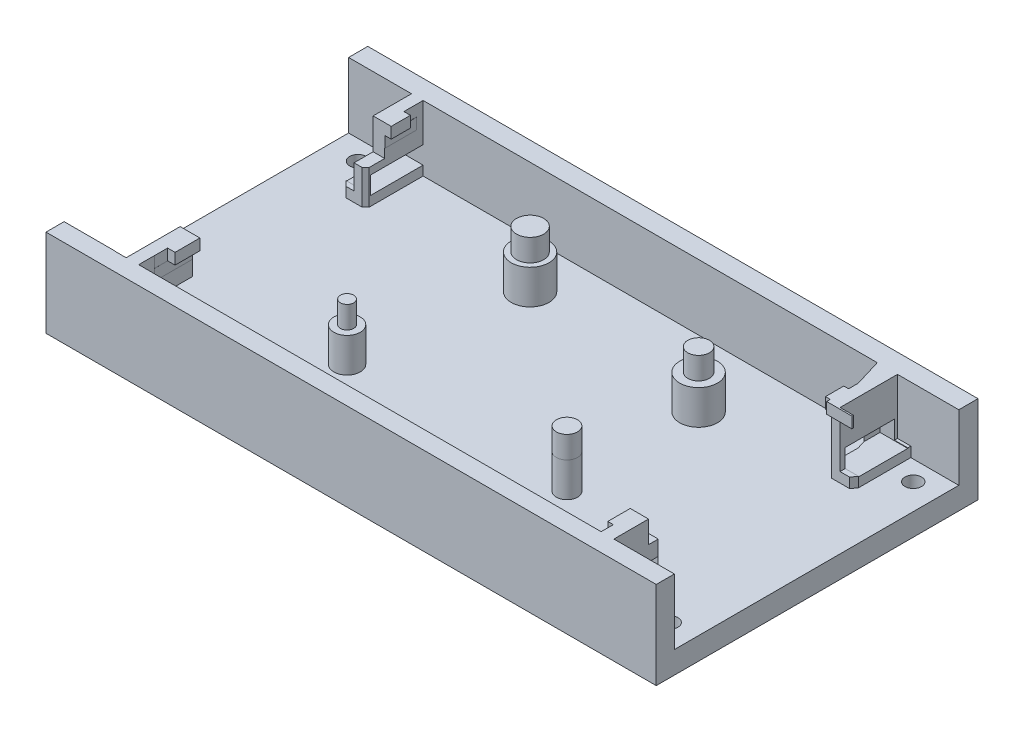
from build123d import *

# Parameters (mm, degrees)
SKETCH1_W            = 110
SKETCH1_H            = 58
BOSS_EXTRUDE1_DEPTH  = 4
SKETCH2_R            = 3.398974158
SKETCH2_R_2          = 3.407761536
SKETCH2_R_3          = 1.902710934
SKETCH2_R_4          = 2.384440654
BOSS_EXTRUDE2_DEPTH  = 1.6
BOSS_EXTRUDE3_DEPTH  = 6.2
SKETCH4_R            = 2.45
SKETCH4_R_2          = 1.95
SKETCH4_R_3          = 1.9
SKETCH4_R_4          = 1.2
BOSS_EXTRUDE4_DEPTH  = 4
BOSS_EXTRUDE5_DEPTH  = 1.6
BOSS_EXTRUDE7_DEPTH  = 2
SKETCH10_W           = 9.685953709
SKETCH10_H           = 3.389605022
CUT_EXTRUDE1_DEPTH   = 5
SKETCH11_W           = 9.457855186
SKETCH11_H           = 3.19445865
CUT_EXTRUDE2_DEPTH   = 5
SKETCH12_W           = 7.571734997
SKETCH12_H           = 3.389605022
CUT_EXTRUDE3_DEPTH   = 5
SKETCH13_W           = 8.877658174
SKETCH13_H           = 3.389605022
CUT_EXTRUDE4_DEPTH   = 5
BOSS_EXTRUDE11_DEPTH = 2
SKETCH15_W           = 2.328463334
SKETCH15_H           = 10.356170305
SKETCH15_W_2         = 2.062506364
SKETCH15_H_2         = 9.72645826
SKETCH15_W_3         = 2.09471635
SKETCH15_H_3         = 7.99735701
SKETCH15_W_4         = 2.398553281
CUT_EXTRUDE5_DEPTH   = 10
SKETCH16_R           = 1.5
CUT_EXTRUDE9_DEPTH   = 5


with BuildPart() as part:
    # Sketch1 → Boss-Extrude1 (new body)
    with BuildSketch(Plane(origin=(0, 0, 0), x_dir=(1, 0, 0), z_dir=(0, 1, 0))):
        Rectangle(SKETCH1_W, SKETCH1_H)
    extrude(amount=BOSS_EXTRUDE1_DEPTH)

    # Sketch2 → Boss-Extrude2 (add)
    with BuildSketch(Plane(origin=(0, 4, 0), x_dir=(1, 0, 0), z_dir=(0, 1, 0))):
        Polygon((46.346119795, 25.541263413), (55, 25.541263413), (55, 29), (-54.994341331, 29), (-54.994341331, 25.541263413), (-45.986579734, 25.541263413), (-45.986579734, 18.10232226), (-45.986579734, 17.980527053), (-45.986579734, 16.083408227), (-45.088264615, 15.185093108), (-42.202263878, 15.185093108), (-41.564501972, 15.822855015), (-41.564501972, 18.10232226), (-41.564501972, 25.541263413), (40.304214547, 25.541263413), (41.797555033, 20.604809993), (41.797555033, 16.117567037), (42.441634266, 15.185093108), (45.678891317, 15.185093108), (46.346119795, 16.117567037), align=None)
        with Locations(Location((-13.880988948, 17.14491543, 0), (0, 0, 270))):
            Circle(SKETCH2_R)
        with Locations(Location((20.080301926, 13.55493457, 0), (0, 0, 270))):
            Circle(SKETCH2_R_2)
        with Locations(Location((20.58969132, -10.683370151, 0), (0, 0, 270))):
            Circle(SKETCH2_R_3)
        with Locations(Location((-19.024959871, -10.704463559, 0), (0, 0, 270))):
            Circle(SKETCH2_R_4)
        Polygon((-55, -25.732689432), (-55, -29), (55, -29), (55, -25.732689432), (46.191771323, -25.732689432), (46.191771323, -17.749211072), (41.797555033, -17.720096968), (41.797555033, -25.732689432), (-41.564501972, -25.732689432), (-41.564501972, -19.505766322), (-41.564501972, -16.046735723), (-45.837931694, -16.046735723), (-45.837931694, -19.079806126), (-45.837931694, -25.732689432), (-46.135227773, -25.732689432), align=None)
    extrude(amount=BOSS_EXTRUDE2_DEPTH)

    # Sketch2 → Boss-Extrude3 (add)
    with BuildSketch(Plane(origin=(0, 4, 0), x_dir=(1, 0, 0), z_dir=(0, 1, 0))):
        Polygon((46.346119795, 25.541263413), (55, 25.541263413), (55, 29), (-54.994341331, 29), (-54.994341331, 25.541263413), (-45.986579734, 25.541263413), (-45.986579734, 18.10232226), (-45.986579734, 17.980527053), (-45.986579734, 16.083408227), (-45.088264615, 15.185093108), (-42.202263878, 15.185093108), (-41.564501972, 15.822855015), (-41.564501972, 18.10232226), (-41.564501972, 25.541263413), (40.304214547, 25.541263413), (41.797555033, 20.604809993), (41.797555033, 16.117567037), (42.441634266, 15.185093108), (45.678891317, 15.185093108), (46.346119795, 16.117567037), align=None)
        with Locations(Location((-13.880988948, 17.14491543, 0), (0, 0, 270))):
            Circle(SKETCH2_R)
        with Locations(Location((20.080301926, 13.55493457, 0), (0, 0, 270))):
            Circle(SKETCH2_R_2)
        with Locations(Location((20.58969132, -10.683370151, 0), (0, 0, 270))):
            Circle(SKETCH2_R_3)
        with Locations(Location((-19.024959871, -10.704463559, 0), (0, 0, 270))):
            Circle(SKETCH2_R_4)
        Polygon((-55, -25.732689432), (-55, -29), (55, -29), (55, -25.732689432), (46.191771323, -25.732689432), (46.191771323, -17.749211072), (41.797555033, -17.720096968), (41.797555033, -25.732689432), (-41.564501972, -25.732689432), (-41.564501972, -19.505766322), (-41.564501972, -16.046735723), (-45.837931694, -16.046735723), (-45.837931694, -19.079806126), (-45.837931694, -25.732689432), (-46.135227773, -25.732689432), align=None)
    extrude(amount=BOSS_EXTRUDE3_DEPTH)

    # Sketch4 → Boss-Extrude4 (add)
    with BuildSketch(Plane(origin=(0, 10.2, 0), x_dir=(1, 0, 0), z_dir=(0, 1, 0))):
        with Locations(Location((-13.880988948, 17.14491543, 0), (0, 0, 270))):
            Circle(SKETCH4_R)
        with Locations(Location((20.080301926, 13.55493457, 0), (0, 0, 270))):
            Circle(SKETCH4_R_2)
        with Locations(Location((20.58969132, -10.683370151, 0), (0, 0, 270))):
            Circle(SKETCH4_R_3)
        with Locations(Location((-19.024959871, -10.704463559, 0), (0, 0, 270))):
            Circle(SKETCH4_R_4)
    extrude(amount=BOSS_EXTRUDE4_DEPTH)

    # Sketch5 → Boss-Extrude5 (add)
    with BuildSketch(Plane(origin=(0, 10.2, 0), x_dir=(1, 0, 0), z_dir=(0, 1, 0))):
        Polygon((-54.994341331, 25.541263413), (-54.994341331, 29), (55, 29), (55, 25.541263413), (46.346119795, 25.541263413), (46.346119795, 16.117567037), (45.678891317, 15.185093108), (42.441634266, 15.185093108), (41.797555033, 16.117567037), (41.797555033, 20.604809993), (40.304214547, 25.541263413), (-41.564501972, 25.541263413), (-41.564501972, 18.624421299), (-45.986579734, 18.624421299), (-45.986579734, 25.541263413), align=None)
        Polygon((-55, -29), (-55, -25.732689432), (-45.837931694, -25.732689432), (-45.837931694, -16.046735723), (-41.564501972, -16.046735723), (-41.564501972, -25.732689432), (41.797555033, -25.732689432), (41.797555033, -17.720096968), (46.191771323, -17.749211072), (46.191771323, -25.732689432), (55, -25.732689432), (55, -29), align=None)
    extrude(amount=BOSS_EXTRUDE5_DEPTH)

    # Sketch8 → Boss-Extrude7 (add)
    with BuildSketch(Plane(origin=(0, 11.8, 0), x_dir=(1, 0, 0), z_dir=(0, 1, 0))):
        Polygon((-45.986579734, 25.541263413), (-54.994341331, 25.541263413), (-54.994341331, 29), (55, 29), (55, 25.541263413), (46.346119795, 25.541263413), (46.346119795, 16.117567037), (45.678891317, 15.185093108), (42.441634266, 15.185093108), (41.797555033, 16.117567037), (41.80446192, 16.117567037), (41.80446192, 20.605491868), (41.797555033, 20.604809993), (40.304214547, 25.541263413), (-41.564501972, 25.541263413), (-41.564501972, 24.347016348), (-41.542415728, 24.347016348), (-41.542415728, 18.624421299), (-45.986579734, 18.624421299), align=None)
        Polygon((-55, -29), (-55, -25.732689432), (-45.837931694, -25.732689432), (-45.837931694, -16.046735723), (-41.564501972, -16.046735723), (-41.553155446, -16.046735723), (-41.553155446, -22.919153082), (-41.564501972, -22.919153082), (-41.564501972, -25.732689432), (41.797555033, -25.732689432), (41.797555033, -23.239047925), (41.783488135, -23.239047925), (41.783488135, -19.482944402), (46.191771323, -19.482944402), (46.191771323, -25.732689432), (55, -25.732689432), (55, -29), align=None)
    extrude(amount=BOSS_EXTRUDE7_DEPTH)

    # Sketch10 → Cut-Extrude1 (cut)
    with BuildSketch(Plane.ZY.offset(45.837931694)):
        with Locations((20.889712577, 7.400343861)):
            Rectangle(SKETCH10_W, SKETCH10_H)
    extrude(amount=-CUT_EXTRUDE1_DEPTH, mode=Mode.SUBTRACT)

    # Sketch11 → Cut-Extrude2 (cut)
    with BuildSketch(Plane.ZY.offset(45.986579734)):
        with Locations((-20.81233582, 7.302770675)):
            Rectangle(SKETCH11_W, SKETCH11_H)
    extrude(amount=-CUT_EXTRUDE2_DEPTH, mode=Mode.SUBTRACT)

    # Sketch12 → Cut-Extrude3 (cut)
    with BuildSketch(Plane(origin=(46.191771323, 0, 0), x_dir=(0, 0, -1), z_dir=(1, 0, 0))):
        with Locations((-21.535078571, 7.400343861)):
            Rectangle(SKETCH12_W, SKETCH12_H)
    extrude(amount=-CUT_EXTRUDE3_DEPTH, mode=Mode.SUBTRACT)

    # Sketch13 → Cut-Extrude4 (cut)
    with BuildSketch(Plane(origin=(46.346119795, 0, 0), x_dir=(0, 0, -1), z_dir=(1, 0, 0))):
        with Locations((20.556396124, 7.400343861)):
            Rectangle(SKETCH13_W, SKETCH13_H)
    extrude(amount=-CUT_EXTRUDE4_DEPTH, mode=Mode.SUBTRACT)

    # Sketch14 → Boss-Extrude11 (add)
    with BuildSketch(Plane(origin=(0, 13.8, 0), x_dir=(1, 0, 0), z_dir=(0, 1, 0))):
        Polygon((-55, -25.732689432), (-55, -29), (55, -29), (55, -25.732689432), (46.191771323, -25.732689432), (46.191771323, -19.482944402), (40.796637058, -19.482944402), (40.796637058, -23.53105864), (41.797555033, -23.53105864), (41.797555033, -25.732689432), (-41.564501972, -25.732689432), (-41.564501972, -22.919153082), (-41.558372671, -22.919153082), (-41.553155446, -20.524286948), (-40.212145481, -20.524286948), (-40.212145481, -16.046735723), (-45.837931694, -16.046735723), (-45.837931694, -25.732689432), align=None)
        Polygon((55, 29), (-54.994341331, 29), (-54.994341331, 25.541263413), (-45.986579734, 25.541263413), (-45.986579734, 18.624421299), (-40.393969825, 18.624421299), (-40.393969825, 22.074882647), (-41.564501972, 22.074882647), (-41.564501972, 25.541263413), (40.304214547, 25.541263413), (41.797555033, 20.604809993), (41.797555033, 18.88036778), (40.93151342, 18.88036778), (40.93151342, 15.577482073), (41.797555033, 15.577482073), (41.797555033, 14.916904931), (46.346119795, 14.916904931), (46.346119795, 25.541263413), (55, 25.541263413), align=None)
    extrude(amount=BOSS_EXTRUDE11_DEPTH)

    # Sketch15 → Cut-Extrude5 (cut)
    with BuildSketch(Plane(origin=(0, 15.8, 0), x_dir=(1, 0, 0), z_dir=(0, 1, 0))):
        with Locations((-44.822348067, 20.36317826)):
            Rectangle(SKETCH15_W, SKETCH15_H)
        with Locations((-44.806678512, -20.909964853)):
            Rectangle(SKETCH15_W_2, SKETCH15_H_2)
        with Locations((45.144413148, -21.734010927)):
            Rectangle(SKETCH15_W_3, SKETCH15_H_3)
        with Locations((45.146843155, 20.36317826)):
            Rectangle(SKETCH15_W_4, SKETCH15_H)
    extrude(amount=-CUT_EXTRUDE5_DEPTH, mode=Mode.SUBTRACT)

    # Sketch16 → Cut-Extrude9 (cut)
    with BuildSketch(Plane(origin=(0, 4, 0), x_dir=(1, 0, 0), z_dir=(0, 1, 0))):
        with Locations(Location((-49.750520398, -21.917426264, 0), (0, 0, 270))):
            Circle(SKETCH16_R)
        with Locations(Location((-49.750520398, 21.99224412, 0), (0, 0, 270))):
            Circle(SKETCH16_R)
        with Locations(Location((50.339499411, -21.917426264, 0), (0, 0, 270))):
            Circle(SKETCH16_R)
        with Locations(Location((50.339499411, 21.99224412, 0), (0, 0, 270))):
            Circle(SKETCH16_R)
    extrude(amount=-CUT_EXTRUDE9_DEPTH, mode=Mode.SUBTRACT)


solid = part.part
